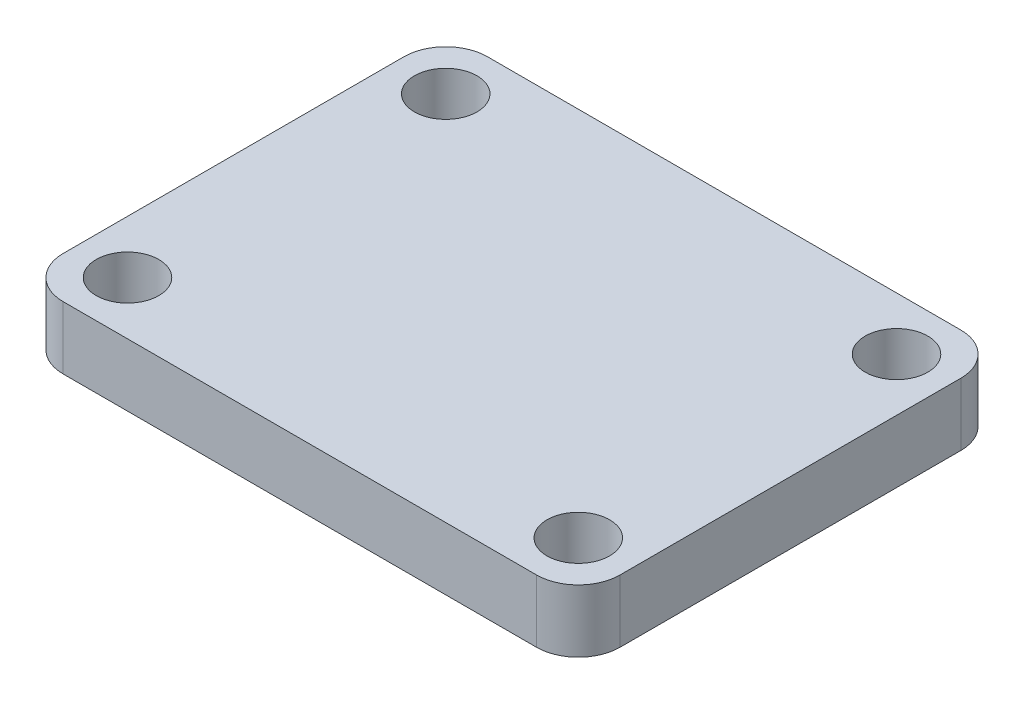
from build123d import *

# Parameters (mm, degrees)
CROQUIS1_W              = 26.67
CROQUIS1_H              = 20.32
SALIENTE_EXTRUIR1_DEPTH = 3
CROQUIS2_R              = 1.5
CORTAR_EXTRUIR1_DEPTH   = 34.662906886
REDONDEO1_R             = 2


with BuildPart() as part:
    # Croquis1 → Saliente-Extruir1 (new body)
    with BuildSketch(Plane(origin=(0, 0, 0), x_dir=(1, 0, 0), z_dir=(0, 1, 0))):
        with Locations((13.335, 10.16)):
            Rectangle(CROQUIS1_W, CROQUIS1_H)
    extrude(amount=SALIENTE_EXTRUIR1_DEPTH)

    # Croquis2 → Cortar-Extruir1 (cut, through all)
    with BuildSketch(Plane(origin=(0, 3, 0), x_dir=(1, 0, 0), z_dir=(0, 1, 0))):
        with Locations(Location((24.13, 2.54, 0), (0, 0, 270))):
            Circle(CROQUIS2_R)
        with Locations(Location((2.54, 2.54, 0), (0, 0, 270))):
            Circle(CROQUIS2_R)
        with Locations(Location((2.54, 17.78, 0), (0, 0, 270))):
            Circle(CROQUIS2_R)
        with Locations(Location((24.13, 17.78, 0), (0, 0, 270))):
            Circle(CROQUIS2_R)
    extrude(amount=-CORTAR_EXTRUIR1_DEPTH, mode=Mode.SUBTRACT)

    # Redondeo1
    redondeo1_edges = [part.edges().sort_by_distance(p)[0] for p in [
        (0, 1.5, -20.32),
        (0, 1.5, 0),
        (26.67, 1.5, 0),
        (26.67, 1.5, -20.32),
    ]]
    fillet(redondeo1_edges, radius=REDONDEO1_R)


solid = part.part
